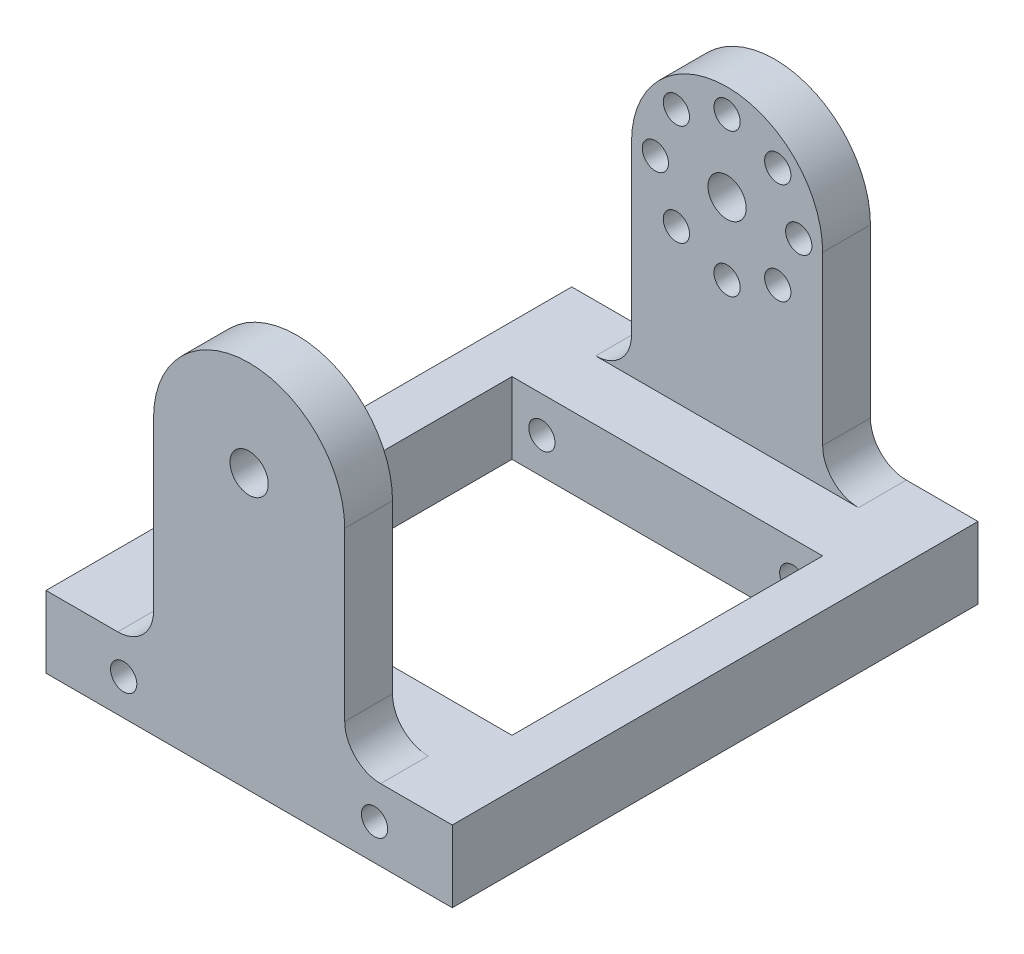
from build123d import *

# Parameters (mm, degrees)
SKETCH_1_R          = 1.1
SKETCH_1_R_2        = 1.6
EXTRUDE_1_DEPTH     = 4
SKETCH_2_W          = 4
SKETCH_2_H          = 6
EXTRUDE_2_DEPTH     = 36
SKETCH_3_R          = 1.6
EXTRUDE_3_DEPTH     = 4
SKETCH_4_W          = 26
SKETCH_4_H          = 5
EXTRUDE_4_DEPTH     = 6
SKETCH_7_R          = 1.1
CUT_EXTRUDE_2_DEPTH = 66.61562314


with BuildPart() as part:
    # ｽｹｯﾁ1 → ﾎﾞｽ - 押し出し1 (new body)
    with BuildSketch(Plane.XY):
        with BuildLine():
            Line((-17, -17), (-17, -23))
            Line((-17, -23), (17, -23))
            Line((17, -23), (17, -17))
            Line((17, -17), (11, -17))
            ThreePointArc((11, -17), (8.878679656, -16.121320344), (8, -14))
            Line((8, -14), (8, 0))
            ThreePointArc((8, 0), (0, 8), (-8, 0))
            Line((-8, 0), (-8, -14))
            ThreePointArc((-8, -14), (-8.878679656, -16.121320344), (-11, -17))
            Line((-11, -17), (-17, -17))
        make_face()
        with Locations((0, 6)):
            Circle(SKETCH_1_R, mode=Mode.SUBTRACT)
        with Locations((4.242640687, 4.242640687)):
            Circle(SKETCH_1_R, mode=Mode.SUBTRACT)
        with Locations((6, 0)):
            Circle(SKETCH_1_R, mode=Mode.SUBTRACT)
        with Locations((4.242640687, -4.242640687)):
            Circle(SKETCH_1_R, mode=Mode.SUBTRACT)
        with Locations((0, -6)):
            Circle(SKETCH_1_R, mode=Mode.SUBTRACT)
        with Locations((-4.242640687, -4.242640687)):
            Circle(SKETCH_1_R, mode=Mode.SUBTRACT)
        with Locations((-6, 0)):
            Circle(SKETCH_1_R, mode=Mode.SUBTRACT)
        with Locations((-4.242640687, 4.242640687)):
            Circle(SKETCH_1_R, mode=Mode.SUBTRACT)
        Circle(SKETCH_1_R_2, mode=Mode.SUBTRACT)
    extrude(amount=EXTRUDE_1_DEPTH)

    # ｽｹｯﾁ2 → ﾎﾞｽ - 押し出し2 (add)
    with BuildSketch(Plane.XY.offset(4)):
        with Locations((-15, -20)):
            Rectangle(SKETCH_2_W, SKETCH_2_H)
        with Locations((15, -20)):
            Rectangle(SKETCH_2_W, SKETCH_2_H)
    extrude(amount=EXTRUDE_2_DEPTH)

    # ｽｹｯﾁ3 → ﾎﾞｽ - 押し出し3 (add)
    with BuildSketch(Plane.XY.offset(40)):
        with BuildLine():
            Line((-11, -17), (-17, -17))
            Line((-17, -17), (-17, -23))
            Line((-17, -23), (17, -23))
            Line((17, -23), (17, -17))
            Line((17, -17), (11, -17))
            ThreePointArc((11, -17), (8.878679656, -16.121320344), (8, -14))
            Line((8, -14), (8, 0))
            ThreePointArc((8, 0), (0, 8), (-8, 0))
            Line((-8, 0), (-8, -14))
            ThreePointArc((-8, -14), (-8.878679656, -16.121320344), (-11, -17))
        make_face()
        Circle(SKETCH_3_R, mode=Mode.SUBTRACT)
    extrude(amount=EXTRUDE_3_DEPTH)

    # ｽｹｯﾁ4 → ﾎﾞｽ - 押し出し4 (add)
    with BuildSketch(Plane(origin=(0, -17, 0), x_dir=(1, 0, 0), z_dir=(0, 1, 0))):
        with Locations((0, -6.5)):
            Rectangle(SKETCH_4_W, SKETCH_4_H)
        with Locations((0, -37.5)):
            Rectangle(SKETCH_4_W, SKETCH_4_H)
    extrude(amount=-EXTRUDE_4_DEPTH)

    # ｽｹｯﾁ7 → ｶｯﾄ - 押し出し2 (cut, through all)
    with BuildSketch(Plane(origin=(-25.9, 0, 44), x_dir=(-1, 0, 0), z_dir=(0, 0, -1))):
        with Locations((-36.4, -20)):
            Circle(SKETCH_7_R)
        with Locations(Location((-15.4, -20, 0), (0, 0, 180))):
            Circle(SKETCH_7_R)
    extrude(amount=CUT_EXTRUDE_2_DEPTH, mode=Mode.SUBTRACT)


solid = part.part
